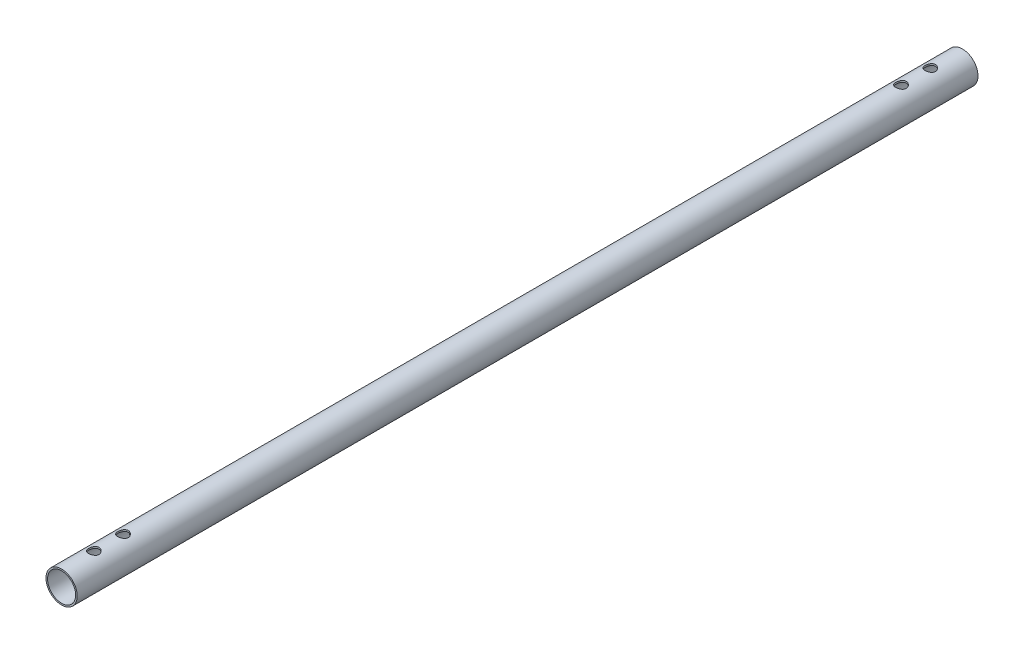
from build123d import *

# Parameters (mm, degrees)
SKETCH1_R               = 13.35
SKETCH1_R_2             = 11.7
BOSS_EXTRUDE1_DEPTH     = 770
SKETCH2_R               = 12
CUT_EXTRUDE1_DEPTH      = 70
CUT_EXTRUDE2_START      = -70
SKETCH3_R               = 12
CUT_EXTRUDE2_DEPTH      = 70
SKETCH4_R               = 4.5
CUT_EXTRUDE3_DEPTH      = 771.231423015
LPATTERN1_COUNT         = 2
LPATTERN1_PITCH         = 25
MIRROR1_COPY_1_SKETCH_R = 4.5
MIRROR1_COPY_1_DEPTH    = 771.231423015


with BuildPart() as part:
    # Sketch1 → Boss-Extrude1 (new body)
    with BuildSketch(Plane.XY):
        Circle(SKETCH1_R)
        Circle(SKETCH1_R_2, mode=Mode.SUBTRACT)
    extrude(amount=BOSS_EXTRUDE1_DEPTH)

    # Sketch2 → Cut-Extrude1 (cut)
    with BuildSketch(Plane.XY.offset(770)):
        Circle(SKETCH2_R)
    extrude(amount=-CUT_EXTRUDE1_DEPTH, mode=Mode.SUBTRACT)

    # Sketch3 → Cut-Extrude2 (cut)
    with BuildSketch(Plane(origin=(0, 0, 0), x_dir=(-1, 0, 0), z_dir=(0, 0, -1)).offset(CUT_EXTRUDE2_START)):
        with Locations(Location((0, 0, 0), (0, 0, 180))):
            Circle(SKETCH3_R)
    extrude(amount=CUT_EXTRUDE2_DEPTH, mode=Mode.SUBTRACT)

    # Sketch4 → Cut-Extrude3 (cut, symmetric)
    with BuildSketch(Plane(origin=(0, 0, 0), x_dir=(1, 0, 0), z_dir=(0, 1, 0))):
        with Locations(Location((0, -27.5, 0), (0, 0, 270))):
            Circle(SKETCH4_R)
    cut_extrude3 = extrude(amount=CUT_EXTRUDE3_DEPTH, both=True, mode=Mode.SUBTRACT)

    # LPattern1: Cut-Extrude3 ×2
    with Locations(*[(0, 0, i * LPATTERN1_PITCH) for i in range(1, LPATTERN1_COUNT)]):
        add(cut_extrude3, mode=Mode.SUBTRACT)

    # Mirror1: Cut-Extrude3 across plane
    add(cut_extrude3.mirror(Plane(origin=(0, 0, 385), x_dir=(1, 0, 0), z_dir=(0, 0, -1))), mode=Mode.SUBTRACT)

    # Mirror1 copy 1 sketch → Mirror1 copy 1 (cut, symmetric)
    with BuildSketch(Plane(origin=(0, 0, 745), x_dir=(1, 0, 0), z_dir=(0, 1, 0))):
        with Locations((0, 27.5)):
            Circle(MIRROR1_COPY_1_SKETCH_R)
    extrude(amount=MIRROR1_COPY_1_DEPTH, both=True, mode=Mode.SUBTRACT)


solid = part.part
